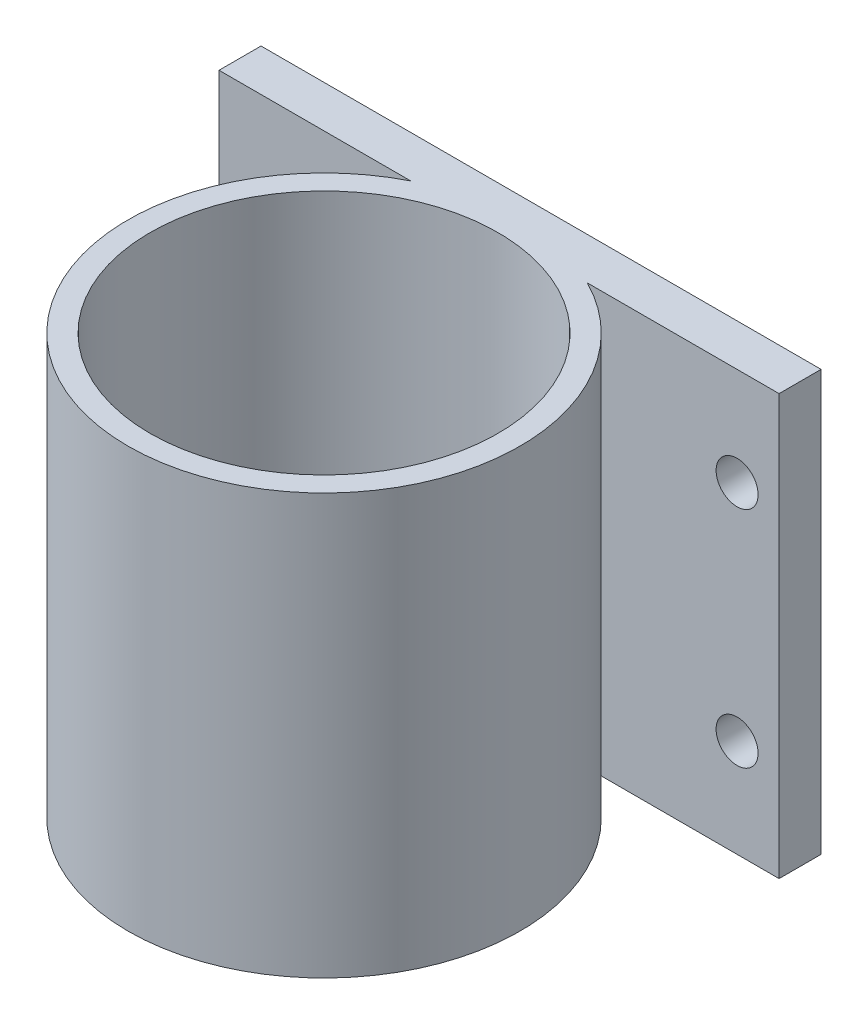
from build123d import *

# Parameters (mm, degrees)
SKETCH1_R           = 14
SKETCH1_R_2         = 12.425
BOSS_EXTRUDE1_DEPTH = 30
SKETCH2_W           = 40
SKETCH2_H           = 3
BOSS_EXTRUDE2_DEPTH = 30
SKETCH3_R           = 1.5
CUT_EXTRUDE1_DEPTH  = 30


with BuildPart() as part:
    # Sketch1 → Boss-Extrude1 (new body)
    with BuildSketch(Plane(origin=(0, 0, 0), x_dir=(1, 0, 0), z_dir=(0, 1, 0))):
        with Locations(Location((0, 0, 0), (0, 0, 270))):
            Circle(SKETCH1_R)
        with Locations(Location((0, 0, 0), (0, 0, 270))):
            Circle(SKETCH1_R_2, mode=Mode.SUBTRACT)
    extrude(amount=BOSS_EXTRUDE1_DEPTH)

    # Sketch2 → Boss-Extrude2 (add)
    with BuildSketch(Plane.XZ):
        with Locations((0, -14)):
            Rectangle(SKETCH2_W, SKETCH2_H)
    extrude(amount=-BOSS_EXTRUDE2_DEPTH)

    # Sketch3 → Cut-Extrude1 (cut)
    with BuildSketch(Plane.XY.offset(-12.5)):
        with Locations((17, 23)):
            Circle(SKETCH3_R)
        with Locations((-17, 23)):
            Circle(SKETCH3_R)
        with Locations((17, 7)):
            Circle(SKETCH3_R)
        with Locations((-17, 7)):
            Circle(SKETCH3_R)
    extrude(amount=-CUT_EXTRUDE1_DEPTH, mode=Mode.SUBTRACT)


solid = part.part
